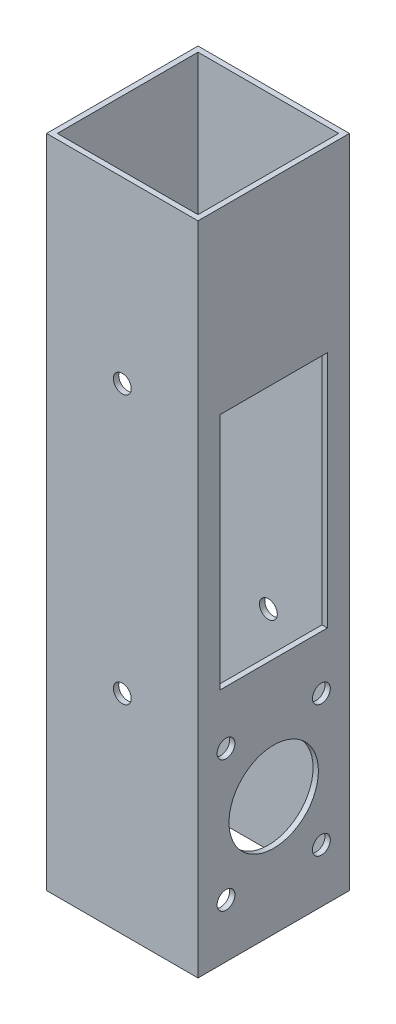
from build123d import *

# Parameters (mm, degrees)
SKETCH1_W           = 25.4
SKETCH1_H           = 25.4
SKETCH1_W_2         = 23.6
SKETCH1_H_2         = 23.6
BOSS_EXTRUDE1_DEPTH = 110
SKETCH2_R           = 7.5
SKETCH2_W           = 18
SKETCH2_H           = 40
CUT_EXTRUDE1_DEPTH  = 25.4
SKETCH3_R           = 1.5
CUT_EXTRUDE2_DEPTH  = 25.4
SKETCH4_R           = 1.5
CUT_EXTRUDE3_DEPTH  = 25.4


with BuildPart() as part:
    # Sketch1 → Boss-Extrude1 (new body)
    with BuildSketch(Plane(origin=(0, 0, 0), x_dir=(1, 0, 0), z_dir=(0, 1, 0))):
        Rectangle(SKETCH1_W, SKETCH1_H)
        Rectangle(SKETCH1_W_2, SKETCH1_H_2, mode=Mode.SUBTRACT)
    extrude(amount=BOSS_EXTRUDE1_DEPTH)

    # Sketch2 → Cut-Extrude1 (cut)
    with BuildSketch(Plane(origin=(12.7, 0, 0), x_dir=(0, 0, -1), z_dir=(1, 0, 0))):
        with Locations((0, 20)):
            Circle(SKETCH2_R)
        with Locations((0, 60)):
            Rectangle(SKETCH2_W, SKETCH2_H)
    extrude(amount=-CUT_EXTRUDE1_DEPTH, mode=Mode.SUBTRACT)

    # Sketch3 → Cut-Extrude2 (cut)
    with BuildSketch(Plane(origin=(0, 0, -12.7), x_dir=(-1, 0, 0), z_dir=(0, 0, -1))):
        with Locations((0, 35)):
            Circle(SKETCH3_R)
        with Locations((0, 80)):
            Circle(SKETCH3_R)
    extrude(amount=-CUT_EXTRUDE2_DEPTH, mode=Mode.SUBTRACT)

    # Sketch4 → Cut-Extrude3 (cut)
    with BuildSketch(Plane(origin=(12.7, 0, 0), x_dir=(0, 0, -1), z_dir=(1, 0, 0))):
        with Locations((8, 9)):
            Circle(SKETCH4_R)
        with Locations(Location((8, 31, 0), (0, 0, 180))):
            Circle(SKETCH4_R)
        with Locations(Location((-8, 9, 0), (0, 0, 180))):
            Circle(SKETCH4_R)
        with Locations((-8, 31)):
            Circle(SKETCH4_R)
    extrude(amount=-CUT_EXTRUDE3_DEPTH, mode=Mode.SUBTRACT)


solid = part.part
